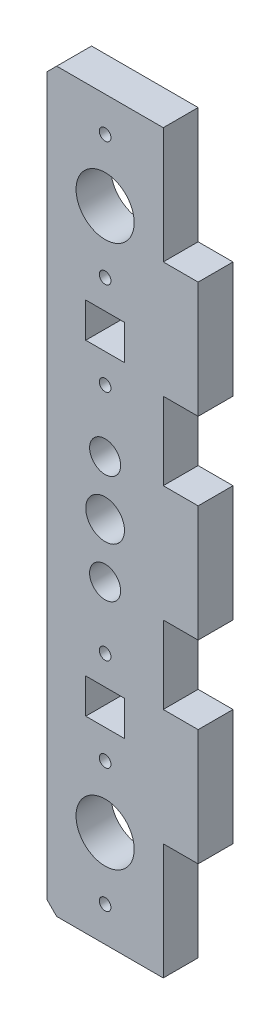
from build123d import *

# Parameters (mm, degrees)
MODEL_R             = 4
MODEL_R_2           = 7.5
MODEL_R_3           = 5
MODEL_R_4           = 1.5
MODEL_W             = 10
MODEL_H             = 9
BOSS_EXTRUDE1_DEPTH = 9


with BuildPart() as part:
    # Model → Boss-Extrude1 (new body)
    with BuildSketch(Plane.XY):
        Polygon((-27.5, 190), (-30, 187.5), (-30, 2.5), (-27.5, 0), (0, 0), (0, 30), (9, 30), (9, 60), (0, 60), (0, 80), (9, 80), (9, 110), (0, 110), (0, 130), (9, 130), (9, 160), (0, 160), (0, 190), align=None)
        with Locations((-15, 109)):
            Circle(MODEL_R, mode=Mode.SUBTRACT)
        with Locations((-15, 165)):
            Circle(MODEL_R_2, mode=Mode.SUBTRACT)
        with Locations(Location((-15, 25, 0), (0, 0, 180))):
            Circle(MODEL_R_2, mode=Mode.SUBTRACT)
        with Locations((-15, 95)):
            Circle(MODEL_R_3, mode=Mode.SUBTRACT)
        with Locations(Location((-15, 81, 0), (0, 0, 180))):
            Circle(MODEL_R, mode=Mode.SUBTRACT)
        with Locations((-15, 41)):
            Circle(MODEL_R_4, mode=Mode.SUBTRACT)
        with Locations(Location((-15, 9, 0), (0, 0, 180))):
            Circle(MODEL_R_4, mode=Mode.SUBTRACT)
        with Locations((-15, 181)):
            Circle(MODEL_R_4, mode=Mode.SUBTRACT)
        with Locations(Location((-15, 149, 0), (0, 0, 180))):
            Circle(MODEL_R_4, mode=Mode.SUBTRACT)
        with Locations((-15, 125)):
            Circle(MODEL_R_4, mode=Mode.SUBTRACT)
        with Locations(Location((-15, 65, 0), (0, 0, 180))):
            Circle(MODEL_R_4, mode=Mode.SUBTRACT)
        with Locations((-15, 53)):
            Rectangle(MODEL_W, MODEL_H, mode=Mode.SUBTRACT)
        with Locations((-15, 137)):
            Rectangle(MODEL_W, MODEL_H, mode=Mode.SUBTRACT)
    extrude(amount=BOSS_EXTRUDE1_DEPTH)


solid = part.part
